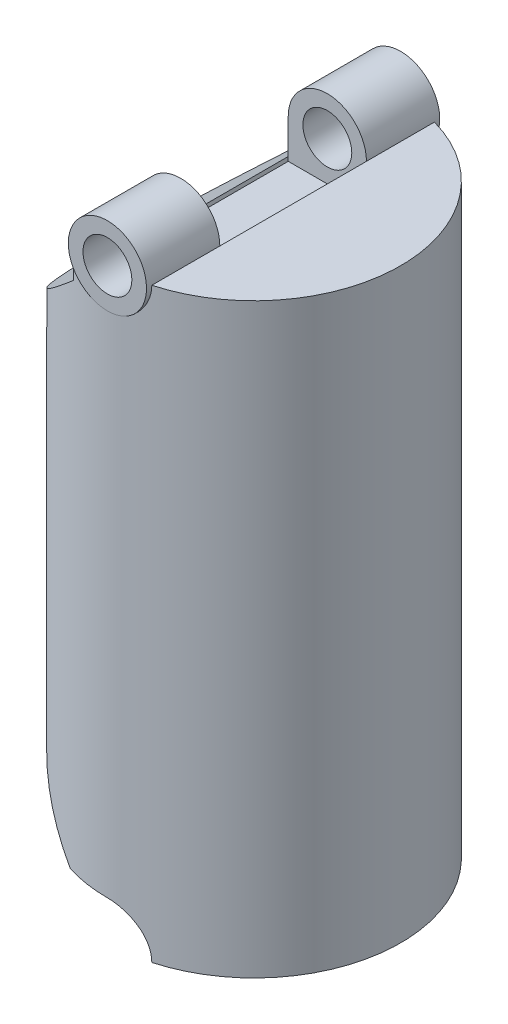
from build123d import *
from build123d.topology import SkipClean

# Parameters (mm, degrees)
CROQUIS1_R              = 15
SALIENTE_EXTRUIR1_DEPTH = 60
CROQUIS8_R              = 2.5
CORTAR_EXTRUIR2_DEPTH   = 15
SALIENTE_EXTRUIR3_START = 15
CROQUIS9_R              = 4
CROQUIS9_R_2            = 2.5
SALIENTE_EXTRUIR3_DEPTH = 7.5
CROQUIS10_R             = 4
SALIENTE_EXTRUIR4_DEPTH = 7.5
CROQUIS12_R             = 2.5
CORTAR_EXTRUIR4_DEPTH   = 30
CORTAR_EXTRUIR5_START   = 37.5
CROQUIS13_R             = 4
CORTAR_EXTRUIR5_DEPTH   = 30
CORTAR_EXTRUIR6_DEPTH   = 15
CROQUIS14_W             = 15
CROQUIS14_H             = 2.5
CORTAR_EXTRUIR7_DEPTH   = 4
CORTAR_EXTRUIR8_DEPTH   = 15
CROQUIS16_R             = 4
CORTAR_EXTRUIR9_DEPTH   = 7.5
CROQUIS17_W             = 15
CROQUIS17_H             = 4
CORTAR_EXTRUIR10_DEPTH  = 4


with BuildPart() as part:
    # Croquis1 → Saliente-Extruir1 (new body)
    with BuildSketch(Plane(origin=(0, 0, 0), x_dir=(1, 0, 0), z_dir=(0, 1, 0))):
        Circle(CROQUIS1_R)
    extrude(amount=SALIENTE_EXTRUIR1_DEPTH)

    # Croquis8 → Cortar-Extruir2 (cut, symmetric)
    with BuildSketch(Plane.XY):
        with Locations((0, 60)):
            Circle(CROQUIS8_R)
    extrude(amount=CORTAR_EXTRUIR2_DEPTH, both=True, mode=Mode.SUBTRACT)

    # Croquis9 → Saliente-Extruir3 (add)
    with BuildSketch(Plane.XY.offset(SALIENTE_EXTRUIR3_START)):
        with Locations((0, 60)):
            Circle(CROQUIS9_R)
        with Locations((0, 60)):
            Circle(CROQUIS9_R_2, mode=Mode.SUBTRACT)
    saliente_extruir3 = extrude(amount=-SALIENTE_EXTRUIR3_DEPTH)

    # Simetría2: Saliente-Extruir3 across plane
    with SkipClean():  # the faces are left unmerged after this step: merging them gives an invalid solid
        add(saliente_extruir3.mirror(Plane.XY))

    # Croquis10 → Saliente-Extruir4 (add, symmetric)
    with SkipClean():  # the faces are left unmerged after this step: merging them gives an invalid solid
        with BuildSketch(Plane.XY):
            Circle(CROQUIS10_R)
        extrude(amount=SALIENTE_EXTRUIR4_DEPTH, both=True)

    # Croquis12 → Cortar-Extruir4 (cut, symmetric)
    with SkipClean():  # the faces are left unmerged after this step: merging them gives an invalid solid
        with BuildSketch(Plane.XY.offset(7.5)):
            Circle(CROQUIS12_R)
        extrude(amount=CORTAR_EXTRUIR4_DEPTH, both=True, mode=Mode.SUBTRACT)

    # Croquis13 → Cortar-Extruir5 (cut)
    with SkipClean():  # the faces are left unmerged after this step: merging them gives an invalid solid
        with BuildSketch(Plane.XY.offset(CORTAR_EXTRUIR5_START)):
            Circle(CROQUIS13_R)
        cortar_extruir5 = extrude(amount=-CORTAR_EXTRUIR5_DEPTH, mode=Mode.SUBTRACT)

    # Simetría3: Cortar-Extruir5 across plane
    with SkipClean():  # the faces are left unmerged after this step: merging them gives an invalid solid
        add(cortar_extruir5.mirror(Plane.XY), mode=Mode.SUBTRACT)

    # Croquis7 → Cortar-Extruir6 (cut, symmetric)
    with SkipClean():  # the faces are left unmerged after this step: merging them gives an invalid solid
        with BuildSketch(Plane.XY):
            Polygon((-4, 56.432940258), (-15, 46.623525966), (-15, 60), (-4, 60), align=None)
        cortar_extruir6 = extrude(amount=CORTAR_EXTRUIR6_DEPTH, both=True, mode=Mode.SUBTRACT)

    # Croquis14 → Cortar-Extruir7 (cut)
    with SkipClean():  # the faces are left unmerged after this step: merging them gives an invalid solid
        with BuildSketch(Plane.ZY.offset(4)):
            with Locations((0, 58.75)):
                Rectangle(CROQUIS14_W, CROQUIS14_H)
        extrude(amount=-CORTAR_EXTRUIR7_DEPTH, mode=Mode.SUBTRACT)

    # Simetría4: Cortar-Extruir6 across plane
    with SkipClean():  # the faces are left unmerged after this step: merging them gives an invalid solid
        add(cortar_extruir6.mirror(Plane.ZX.offset(30)), mode=Mode.SUBTRACT)

    # Croquis15 → Cortar-Extruir8 (cut, symmetric)
    with SkipClean():  # the faces are left unmerged after this step: merging them gives an invalid solid
        with BuildSketch(Plane.XY):
            with BuildLine():
                Line((0, 4), (-8.002010921, 4))
                Line((-8.002010921, 4), (-8.002010921, -4.658510033))
                Line((-8.002010921, -4.658510033), (0, -4.658510033))
                Line((0, -4.658510033), (0, -4))
                ThreePointArc((0, -4), (-4, 0), (0, 4))
            make_face()
        extrude(amount=CORTAR_EXTRUIR8_DEPTH, both=True, mode=Mode.SUBTRACT)

    # Croquis16 → Cortar-Extruir9 (cut, symmetric)
    with SkipClean():  # the faces are left unmerged after this step: merging them gives an invalid solid
        with BuildSketch(Plane.XY):
            with Locations((0, 60)):
                Circle(CROQUIS16_R)
        extrude(amount=CORTAR_EXTRUIR9_DEPTH, both=True, mode=Mode.SUBTRACT)

    # Croquis17 → Cortar-Extruir10 (cut)
    with SkipClean():  # the faces are left unmerged after this step: merging them gives an invalid solid
        with BuildSketch(Plane.ZY.offset(4)):
            with Locations((0, 58)):
                Rectangle(CROQUIS17_W, CROQUIS17_H)
        extrude(amount=-CORTAR_EXTRUIR10_DEPTH, mode=Mode.SUBTRACT)


solid = part.part
